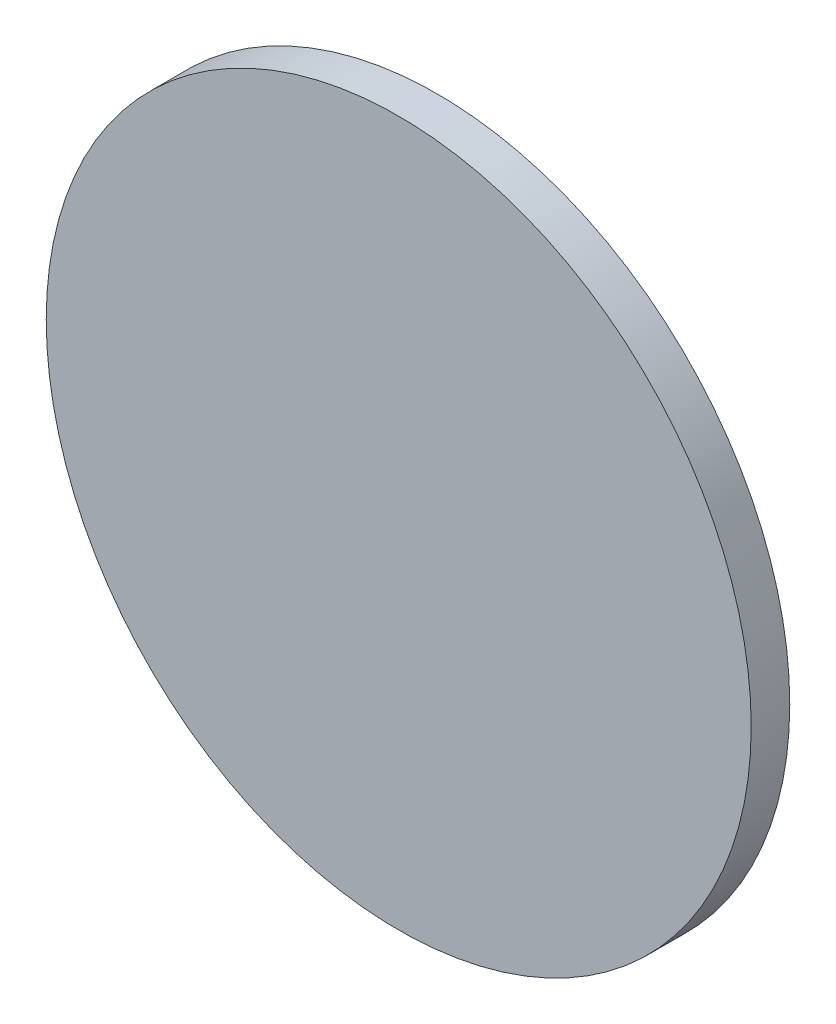
from build123d import *

# Parameters (mm, degrees)
SKETCH_1_R      = 64
EXTRUDE_1_DEPTH = 7


with BuildPart() as part:
    # 草图1 → 凸台-拉伸1 (new body)
    with BuildSketch(Plane.XY):
        Circle(SKETCH_1_R)
    extrude(amount=EXTRUDE_1_DEPTH)


solid = part.part
